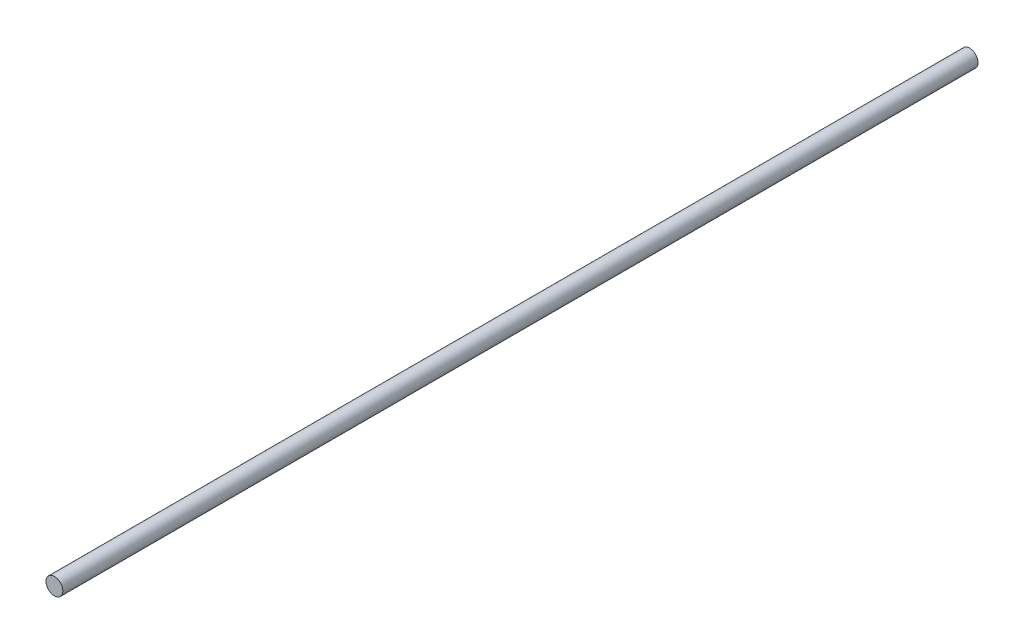
from build123d import *

# Parameters (mm, degrees)
CROQUIS1_R              = 4
SALIENTE_EXTRUIR1_DEPTH = 435


with BuildPart() as part:
    # Croquis1 → Saliente-Extruir1 (new body)
    with BuildSketch(Plane.XY):
        with Locations(Location((0, 0, 0), (0, 0, 180))):
            Circle(CROQUIS1_R)
    extrude(amount=SALIENTE_EXTRUIR1_DEPTH)


solid = part.part
